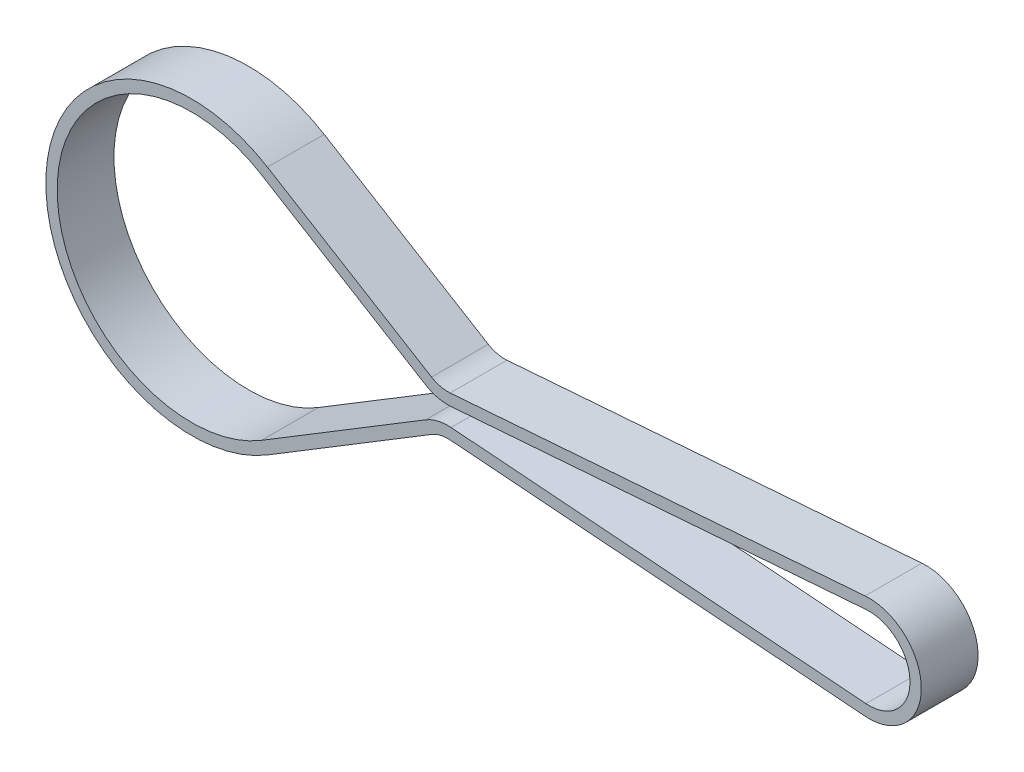
from build123d import *

# Parameters (mm, degrees)
EXTRUDE_THIN1_DEPTH      = 5.3
EXTRUDE_THIN1_DEPTH_BACK = 5.7


with BuildPart() as part:
    # Sketch2 → Extrude-Thin1 (new, two sides: drawn at the far end of the back side and taken through both)
    with BuildSketch(Plane.XY.offset(-EXTRUDE_THIN1_DEPTH_BACK)):
        with BuildLine():
            Line((0.462760139, 13.947687746), (80.869502603, 20.095533609))
            ThreePointArc((80.869502603, 20.095533609), (91.766400364, 9.999999102), (80.869500812, -0.095533472))
            Line((80.869500812, -0.095533472), (0.462758217, 6.052326745))
            ThreePointArc((0.462758217, 6.052326745), (-1.413622714, 5.903090598), (-3.154066984, 5.186201086))
            Line((-3.154066984, 5.186201086), (-34.947818561, -14.149620542))
            ThreePointArc((-34.947818561, -14.149620542), (-77.899753322, 9.99999468), (-34.947827652, 34.149626071))
            Line((-34.947827652, 34.149626071), (-3.154062037, 14.813812299))
            ThreePointArc((-3.154062037, 14.813812299), (-1.413619132, 14.096923834), (0.462760139, 13.947687746))
        make_face()
        with BuildLine():
            Line((0.630481134, 11.754090319), (81.037223598, 17.901936183))
            ThreePointArc((81.037223598, 17.901936183), (89.566400364, 9.999999297), (81.037222196, 2.098063925))
            Line((81.037222196, 2.098063925), (0.630479601, 8.245924142))
            ThreePointArc((0.630479601, 8.245924142), (-1.925973496, 8.042599111), (-4.29722129, 7.06588144))
            Line((-4.29722129, 7.06588144), (-36.090972868, -12.269940189))
            ThreePointArc((-36.090972868, -12.269940189), (-75.699753322, 9.999995094), (-36.090981251, 32.269945287))
            Line((-36.090981251, 32.269945287), (-4.297215636, 12.934131515))
            ThreePointArc((-4.297215636, 12.934131515), (-1.925969701, 11.95741527), (0.630481134, 11.754090319))
        make_face(mode=Mode.SUBTRACT)
    extrude(amount=EXTRUDE_THIN1_DEPTH + EXTRUDE_THIN1_DEPTH_BACK)


solid = part.part
